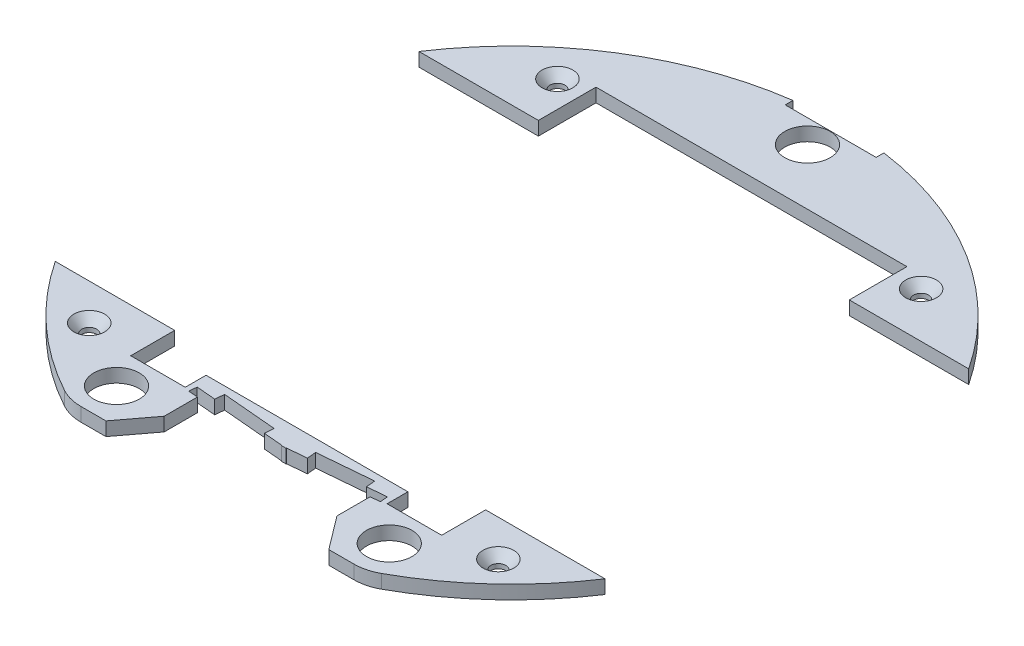
from build123d import *
from OCP.BRepFilletAPI import BRepFilletAPI_MakeChamfer

# Parameters (mm, degrees)
BOSS_EXTRUDE1_DEPTH = 3
CUT_EXTRUDE1_DEPTH  = 103.574363269
SKETCH3_W           = 38.3
SKETCH3_H           = 80
CUT_EXTRUDE2_DEPTH  = 103.574363269
CUT_EXTRUDE3_DEPTH  = 95.453692358
SKETCH5_W           = 38
SKETCH5_H           = 14.605577538
CUT_EXTRUDE4_DEPTH  = 95.453692358
SKETCH6_W           = 68.4
SKETCH6_H           = 3
CUT_EXTRUDE5_DEPTH  = 95.453692358
SKETCH7_R           = 5
CUT_EXTRUDE6_DEPTH  = 95.453692358
SKETCH11_R          = 5
CUT_EXTRUDE10_DEPTH = 95.453692358
CUT_EXTRUDE11_DEPTH = 95.453692358
SKETCH14_R          = 1.65
CUT_EXTRUDE12_DEPTH = 95.453692358
SKETCH15_W          = 20
SKETCH15_H          = 1.7
CUT_EXTRUDE13_DEPTH = 10
CHAMFER1_SIZE       = 2
CHAMFER1_SIZE2      = 1.738573476
CHAMFER2_SIZE       = 2
CHAMFER2_SIZE2      = 1.738573476


with BuildPart() as part:
    # Sketch1 → Boss-Extrude1 (new body)
    with BuildSketch(Plane(origin=(0, 0, 0), x_dir=(1, 0, 0), z_dir=(0, 1, 0))):
        with BuildLine():
            Line((-30.029977361, -64.812867647), (30.029977361, -64.812867647))
            ThreePointArc((30.029977361, -64.812867647), (32.509837414, -64.500503794), (34.834773739, -63.582926471))
            ThreePointArc((34.834773739, -63.582926471), (0, 72.5), (-34.834773739, -63.582926471))
            ThreePointArc((-34.834773739, -63.582926471), (-32.509837414, -64.500503794), (-30.029977361, -64.812867647))
        make_face()
    extrude(amount=BOSS_EXTRUDE1_DEPTH)

    # Sketch2 → Cut-Extrude1 (cut, through all)
    with BuildSketch(Plane(origin=(0, 3, 0), x_dir=(1, 0, 0), z_dir=(0, 1, 0))):
        Polygon((22.2, -49.675685802), (22.2, -45.1), (-22.2, -45.1), (-22.2, -49.675685802), (-34.2, -49.675685802), (-34.2, 49.675685802), (-22.2, 49.675685802), (-22.2, 45.5), (22.2, 45.5), (22.2, 49.675685802), (34.2, 49.675685802), (34.2, -49.675685802), align=None)
    extrude(amount=-CUT_EXTRUDE1_DEPTH, mode=Mode.SUBTRACT)

    # Sketch3 → Cut-Extrude2 (cut, through all)
    with BuildSketch(Plane(origin=(0, 3, 0), x_dir=(1, 0, 0), z_dir=(0, 1, 0))):
        with Locations((-53.35, 0)):
            Rectangle(SKETCH3_W, SKETCH3_H)
        with Locations((53.35, 0)):
            Rectangle(SKETCH3_W, SKETCH3_H)
    extrude(amount=-CUT_EXTRUDE2_DEPTH, mode=Mode.SUBTRACT)


with BuildPart() as cut_extrude2_piece_1:
    # of the separate pieces the step leaves, piece 1, a body of its own (cut_extrude2_pieces)
    add(part.part.solids().sort_by_distance((60.466933112, 0, -40))[0])

    # Sketch6 → Cut-Extrude5 (cut, through all)
    with BuildSketch(Plane(origin=(0, 3, 0), x_dir=(1, 0, 0), z_dir=(0, 1, 0))):
        with Locations((0, 51.175685802)):
            Rectangle(SKETCH6_W, SKETCH6_H)
    extrude(amount=-CUT_EXTRUDE5_DEPTH, mode=Mode.SUBTRACT)


with BuildPart() as cut_extrude2_piece_2:
    # of the separate pieces the step leaves, piece 2, a body of its own (cut_extrude2_pieces)
    add(part.part.solids().sort_by_distance((-34.834773739, 0, 63.582926471))[0])

    # Sketch4 → Cut-Extrude3 (cut, through all)
    with BuildSketch(Plane(origin=(0, 3, 0), x_dir=(1, 0, 0), z_dir=(0, 1, 0))):
        Polygon((-21.070156074, -50.026174921), (-0.648164763, -51.812867647), (-0.5, -50.11933666), (-20.921991311, -48.332643934), align=None)
        Polygon((21.070156074, -50.026174921), (20.921991311, -48.332643934), (0.5, -50.11933666), (0.648164763, -51.812867647), align=None)
    extrude(amount=-CUT_EXTRUDE3_DEPTH, mode=Mode.SUBTRACT)

    # Sketch5 → Cut-Extrude4 (cut, through all)
    with BuildSketch(Plane(origin=(0, 3, 0), x_dir=(1, 0, 0), z_dir=(0, 1, 0))):
        with Locations((0, -57.510078878)):
            Rectangle(SKETCH5_W, SKETCH5_H)
        Polygon((16.688163844, -48.703055841), (4.733827467, -49.748924754), (4.559515981, -47.756535357), (16.513852358, -46.710666444), align=None)
        Polygon((-16.513852358, -46.710666444), (-4.559515981, -47.756535357), (-4.733827467, -49.748924754), (-16.688163844, -48.703055841), align=None)
    extrude(amount=-CUT_EXTRUDE4_DEPTH, mode=Mode.SUBTRACT)

    # Sketch7 → Cut-Extrude6 (cut, through all)
    with BuildSketch(Plane(origin=(0, 3, 0), x_dir=(1, 0, 0), z_dir=(0, 1, 0))):
        with Locations(Location((-30, -57, 0), (0, 0, 90))):
            Circle(SKETCH7_R)
        with Locations(Location((30, -57, 0), (0, 0, 270))):
            Circle(SKETCH7_R)
    extrude(amount=-CUT_EXTRUDE6_DEPTH, mode=Mode.SUBTRACT)

    # Sketch13 → Cut-Extrude11 (cut, through all)
    with BuildSketch(Plane(origin=(0, 3, 0), x_dir=(1, 0, 0), z_dir=(0, 1, 0))):
        Polygon((19, -57.510078878), (24.514988681, -64.812867647), (19, -64.812867647), align=None)
        Polygon((-19, -64.812867647), (-19, -57.510078878), (-24.514988681, -64.812867647), align=None)
    extrude(amount=-CUT_EXTRUDE11_DEPTH, mode=Mode.SUBTRACT)


with BuildPart() as cut_extrude5_kept_piece:
    # of the separate pieces the step leaves, the one the design keeps (cut_extrude5_pieces_kept)
    add(cut_extrude2_piece_1.part.solids().sort_by_distance((60.466933112, 0, -40))[0])

    # Sketch11 → Cut-Extrude10 (cut, through all)
    with BuildSketch(Plane(origin=(0, 3, 0), x_dir=(1, 0, 0), z_dir=(0, 1, 0))):
        with Locations(Location((0, 65, 0), (0, 0, 270))):
            Circle(SKETCH11_R)
    extrude(amount=-CUT_EXTRUDE10_DEPTH, mode=Mode.SUBTRACT)


with BuildPart() as cut_extrude12_tool:
    # Sketch14 → Cut-Extrude12 (new, through all)
    with BuildSketch(Plane(origin=(0, 3, 0), x_dir=(1, 0, 0), z_dir=(0, 1, 0))):
        with Locations(Location((45, -48, 0), (0, 0, 270))):
            Circle(SKETCH14_R)
        with Locations(Location((-45, -48, 0), (0, 0, 90))):
            Circle(SKETCH14_R)
        with Locations(Location((40, 50, 0), (0, 0, 270))):
            Circle(SKETCH14_R)
        with Locations(Location((-40, 50, 0), (0, 0, 90))):
            Circle(SKETCH14_R)
    extrude(amount=-CUT_EXTRUDE12_DEPTH)


with BuildPart() as cut_extrude2_piece_2_1:
    add(cut_extrude2_piece_2.part)

    # Cut-Extrude12: cut by cut_extrude12_tool
    add(cut_extrude12_tool.part, mode=Mode.SUBTRACT)

    # Chamfer1: one chamfer whose edges measure the first distance from different faces: ONE call of the kernel's chamfer builder (chamfer() names one face for all edges)
    chamfer1_edges_1 = [cut_extrude2_piece_2_1.edges().sort_by_distance(p)[0] for p in [
        (45, 3, 46.35),
    ]]
    chamfer1_side_1 = [cut_extrude2_piece_2_1.faces().sort_by_distance(p)[0] for p in [
        (45, 1.5, 46.35),
    ]]
    chamfer1_edges_2 = [cut_extrude2_piece_2_1.edges().sort_by_distance(p)[0] for p in [
        (-45, 3, 49.65),
    ]]
    chamfer1_side_2 = [cut_extrude2_piece_2_1.faces().sort_by_distance(p)[0] for p in [
        (-45, 1.5, 49.65),
    ]]
    chamfer1 = BRepFilletAPI_MakeChamfer(cut_extrude2_piece_2_1.part.solid().wrapped)
    for e in chamfer1_edges_1:
        chamfer1.Add(CHAMFER1_SIZE, CHAMFER1_SIZE2, e.wrapped, chamfer1_side_1[0].wrapped)  # the first distance lies on this face
    for e in chamfer1_edges_2:
        chamfer1.Add(CHAMFER1_SIZE, CHAMFER1_SIZE2, e.wrapped, chamfer1_side_2[0].wrapped)  # the first distance lies on this face
    add(Compound.cast(chamfer1.Shape()), mode=Mode.REPLACE)


with BuildPart() as cut_extrude5_kept_piece_1:
    add(cut_extrude5_kept_piece.part)

    # Cut-Extrude12: cut by cut_extrude12_tool
    add(cut_extrude12_tool.part, mode=Mode.SUBTRACT)

    # Sketch15 → Cut-Extrude13 (cut)
    with BuildSketch(Plane(origin=(0, 3, 0), x_dir=(1, 0, 0), z_dir=(0, 1, 0))):
        with Locations((0, 70.957033082)):
            Rectangle(SKETCH15_W, SKETCH15_H)
    extrude(amount=-CUT_EXTRUDE13_DEPTH, mode=Mode.SUBTRACT)


with BuildPart() as body_3:
    # of the pieces the cut leaves, the one that is kept (cut_extrude13_keep)
    add(cut_extrude5_kept_piece_1.part.solids().sort_by_distance((60.466933112, 0, -40))[0])

    # Chamfer2: one chamfer whose edges measure the first distance from different faces: ONE call of the kernel's chamfer builder (chamfer() names one face for all edges)
    chamfer2_edges_1 = [body_3.edges().sort_by_distance(p)[0] for p in [
        (-40, 3, -48.35),
    ]]
    chamfer2_side_1 = [body_3.faces().sort_by_distance(p)[0] for p in [
        (-40, 1.5, -48.35),
    ]]
    chamfer2_edges_2 = [body_3.edges().sort_by_distance(p)[0] for p in [
        (40, 3, -51.65),
    ]]
    chamfer2_side_2 = [body_3.faces().sort_by_distance(p)[0] for p in [
        (40, 1.5, -51.65),
    ]]
    chamfer2 = BRepFilletAPI_MakeChamfer(body_3.part.solid().wrapped)
    for e in chamfer2_edges_1:
        chamfer2.Add(CHAMFER2_SIZE, CHAMFER2_SIZE2, e.wrapped, chamfer2_side_1[0].wrapped)  # the first distance lies on this face
    for e in chamfer2_edges_2:
        chamfer2.Add(CHAMFER2_SIZE, CHAMFER2_SIZE2, e.wrapped, chamfer2_side_2[0].wrapped)  # the first distance lies on this face
    add(Compound.cast(chamfer2.Shape()), mode=Mode.REPLACE)


solid = Compound([cut_extrude2_piece_2_1.part, body_3.part])
